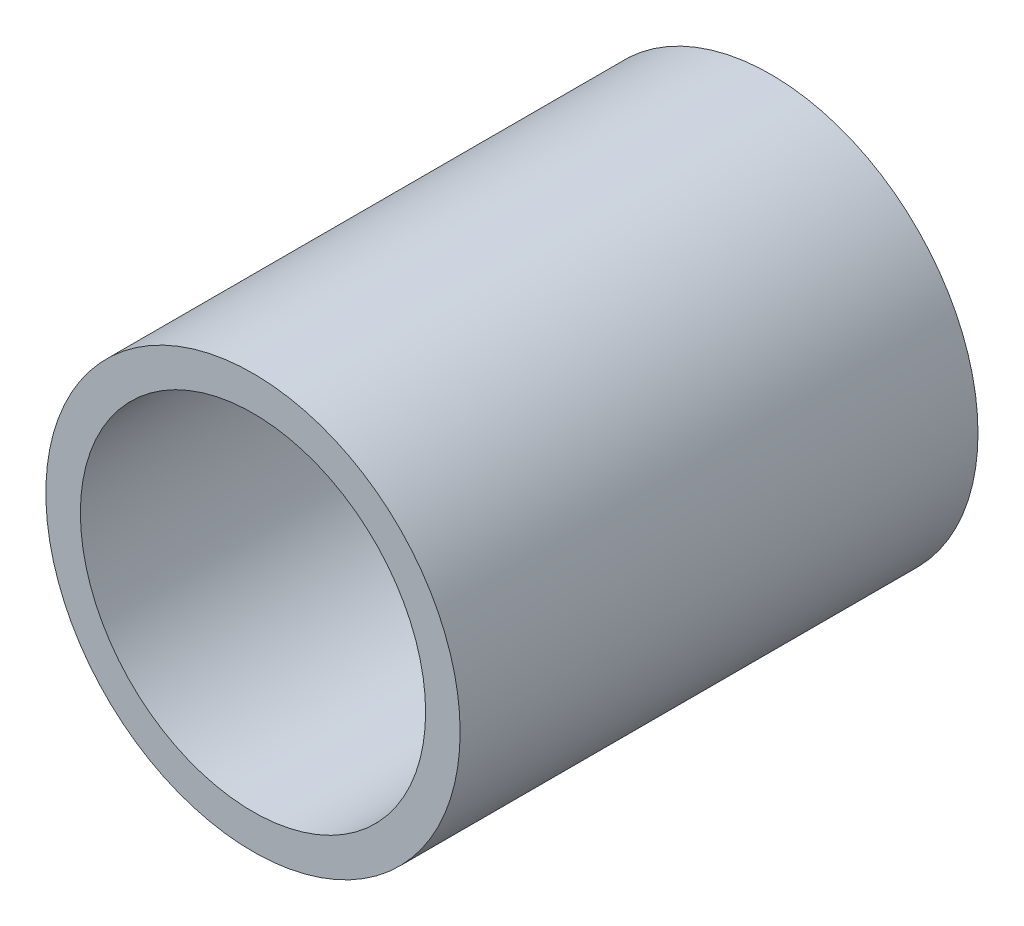
from build123d import *

# Parameters (mm, degrees)
SKETCH1_R           = 9.525
SKETCH1_R_2         = 7.9375
BOSS_EXTRUDE1_DEPTH = 23.8125


with BuildPart() as part:
    # Sketch1 → Boss-Extrude1 (new body)
    with BuildSketch(Plane.XY):
        Circle(SKETCH1_R)
        Circle(SKETCH1_R_2, mode=Mode.SUBTRACT)
    extrude(amount=BOSS_EXTRUDE1_DEPTH)


solid = part.part
